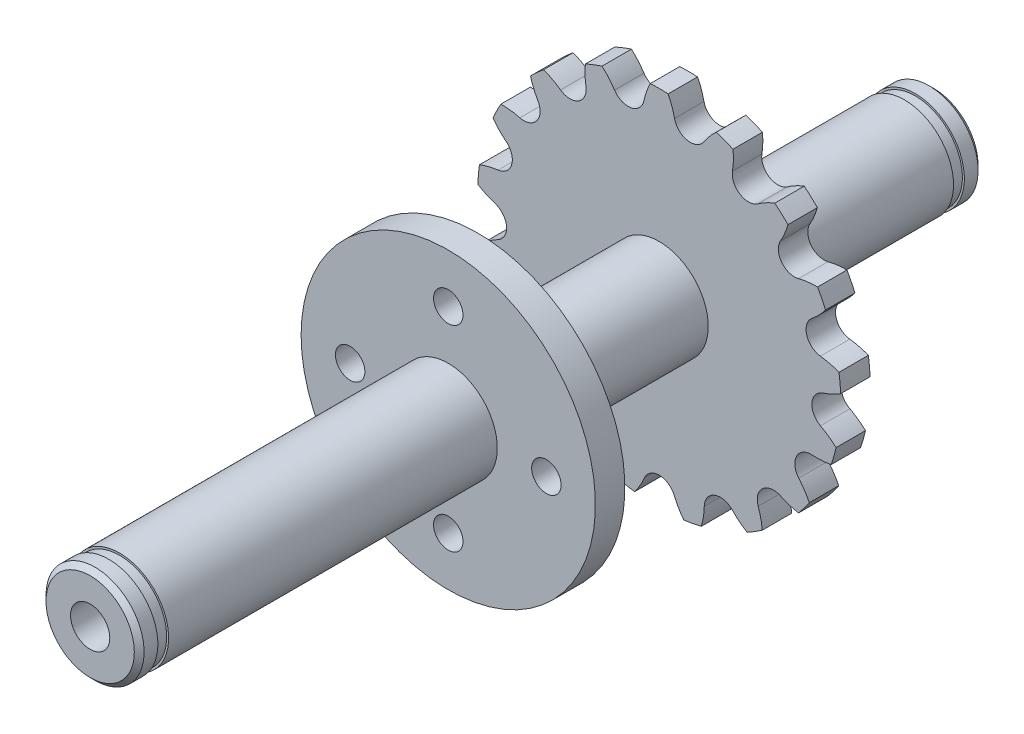
from build123d import *

# Parameters (mm, degrees)
EXTRUDE_2_DEPTH     = 3
SKETCH_2_R          = 5
EXTRUDE_3_DEPTH     = 25
EXTRUDE_START       = 58
SKETCH_3_R          = 5
EXTRUDE_4_DEPTH     = 58
SKETCH_4_R          = 15
EXTRUDE_5_DEPTH     = 3
SKETCH_5_R          = 1.5
CUT_EXTRUDE_1_DEPTH = 3
SKETCH_7_R          = 2
CUT_EXTRUDE_2_DEPTH = 90
SKETCH_9_W          = 0.2
SKETCH_9_H          = 1.1
CHAMFER_3_SIZE      = 0.5


with BuildPart() as part:
    # 草图1 → 凸台-拉伸2 (new body)
    with BuildSketch(Plane.XY):
        with BuildLine():
            ThreePointArc((-11.779760181, 14.271379579), (-12.466737886, 13.675360013), (-13.123601243, 13.046306581))
            ThreePointArc((-13.123601243, 13.046306581), (-12.803108373, 12.120767872), (-12.365117817, 11.24469604))
            ThreePointArc((-12.365117817, 11.24469604), (-12.142820781, 10.31561124), (-12.473009262, 9.419179367))
            ThreePointArc((-12.473009262, 9.419179367), (-13.244860059, 8.856275392), (-14.199312115, 8.815830257))
            ThreePointArc((-14.199312115, 8.815830257), (-15.161802274, 8.997352368), (-16.139716175, 9.052324938))
            ThreePointArc((-16.139716175, 9.052324938), (-16.564996707, 8.248388274), (-16.950263236, 7.424527004))
            ThreePointArc((-16.950263236, 7.424527004), (-16.317069389, 6.677263239), (-15.592181711, 6.018571022))
            ThreePointArc((-15.592181711, 6.018571022), (-15.049271757, 5.2325282), (-15.033334803, 4.277352535))
            ThreePointArc((-15.033334803, 4.277352535), (-15.549719866, 3.473635543), (-16.425109435, 3.091133726))
            ThreePointArc((-16.425109435, 3.091133726), (-17.388178129, 2.912706505), (-18.319914067, 2.610703653))
            ThreePointArc((-18.319914067, 2.610703653), (-18.426060932, 1.707425992), (-18.487698254, 0.800023914))
            ThreePointArc((-18.487698254, 0.800023914), (-17.627319769, 0.331957205), (-16.713435066, -0.020395362))
            ThreePointArc((-16.713435066, -0.020395362), (-15.923235192, -0.557236769), (-15.563325175, -1.442154458))
            ThreePointArc((-15.563325175, -1.442154458), (-15.754503841, -2.378138035), (-16.432604711, -3.051037542))
            ThreePointArc((-16.432604711, -3.051037542), (-17.266184176, -3.565316511), (-18.02590605, -4.183507626))
            ThreePointArc((-18.02590605, -4.183507626), (-17.798583527, -5.064133631), (-17.528267179, -5.932526839))
            ThreePointArc((-17.528267179, -5.932526839), (-16.556902937, -6.058181489), (-15.577446402, -6.056607239))
            ThreePointArc((-15.577446402, -6.056607239), (-14.64667748, -6.271743824), (-13.991402244, -6.966890501))
            ThreePointArc((-13.991402244, -6.966890501), (-13.831554774, -7.908730892), (-14.220785664, -8.781149285))
            ThreePointArc((-14.220785664, -8.781149285), (-14.812296375, -9.561823776), (-15.297399536, -10.412713019))
            ThreePointArc((-15.297399536, -10.412713019), (-14.767308791, -11.151753946), (-14.201546494, -11.863856968))
            ThreePointArc((-14.201546494, -11.863856968), (-13.250384619, -11.630129203), (-12.337637284, -11.274840748))
            ThreePointArc((-12.337637284, -11.274840748), (-11.392004814, -11.139217123), (-10.52986291, -11.550709376))
            ThreePointArc((-10.52986291, -11.550709376), (-10.040577591, -12.371205819), (-10.088370713, -13.325318158))
            ThreePointArc((-10.088370713, -13.325318158), (-10.357925871, -14.266953756), (-10.502894449, -15.23562382))
            ThreePointArc((-10.502894449, -15.23562382), (-9.741627174, -15.733268097), (-8.956828262, -16.192907475))
            ThreePointArc((-8.956828262, -16.192907475), (-8.154328435, -15.631363523), (-7.431561886, -14.970344538))
            ThreePointArc((-7.431561886, -14.970344538), (-6.598778773, -14.502277424), (-5.646207243, -14.574540946))
            ThreePointArc((-5.646207243, -14.574540946), (-4.893564768, -15.162880849), (-4.593465396, -16.069828976))
            ThreePointArc((-4.593465396, -16.069828976), (-4.504660083, -17.045252575), (-4.289915268, -18.000879201))
            ThreePointArc((-4.289915268, -18.000879201), (-3.400284827, -18.18991721), (-2.502440741, -18.335016099))
            ThreePointArc((-2.502440741, -18.335016099), (-1.956985011, -17.521495584), (-1.521812876, -16.644020345))
            ThreePointArc((-1.521812876, -16.644020345), (-0.914351093, -15.9067248), (0, -15.63))
            ThreePointArc((0, -15.63), (0.914351093, -15.9067248), (1.521812876, -16.644020345))
            ThreePointArc((1.521812876, -16.644020345), (1.956985011, -17.521495584), (2.502440741, -18.335016099))
            ThreePointArc((2.502440741, -18.335016099), (3.400284827, -18.18991721), (4.289915268, -18.000879201))
            ThreePointArc((4.289915268, -18.000879201), (4.504660083, -17.045252575), (4.593465396, -16.069828976))
            ThreePointArc((4.593465396, -16.069828976), (4.893564768, -15.162880849), (5.646207243, -14.574540946))
            ThreePointArc((5.646207243, -14.574540946), (6.598778773, -14.502277424), (7.431561886, -14.970344538))
            ThreePointArc((7.431561886, -14.970344538), (8.154328435, -15.631363523), (8.956828262, -16.192907475))
            ThreePointArc((8.956828262, -16.192907475), (9.741627174, -15.733268097), (10.502894449, -15.23562382))
            ThreePointArc((10.502894449, -15.23562382), (10.357925871, -14.266953756), (10.088370713, -13.325318158))
            ThreePointArc((10.088370713, -13.325318158), (10.040577591, -12.371205819), (10.52986291, -11.550709376))
            ThreePointArc((10.52986291, -11.550709376), (11.392004814, -11.139217123), (12.337637284, -11.274840748))
            ThreePointArc((12.337637284, -11.274840748), (13.250384619, -11.630129203), (14.201546494, -11.863856968))
            ThreePointArc((14.201546494, -11.863856968), (14.767308791, -11.151753946), (15.297399536, -10.412713019))
            ThreePointArc((15.297399536, -10.412713019), (14.812296375, -9.561823776), (14.220785664, -8.781149285))
            ThreePointArc((14.220785664, -8.781149285), (13.831554774, -7.908730892), (13.991402244, -6.966890501))
            ThreePointArc((13.991402244, -6.966890501), (14.64667748, -6.271743824), (15.577446402, -6.056607239))
            ThreePointArc((15.577446402, -6.056607239), (16.556902937, -6.058181489), (17.528267179, -5.932526839))
            ThreePointArc((17.528267179, -5.932526839), (17.798583527, -5.064133631), (18.02590605, -4.183507626))
            ThreePointArc((18.02590605, -4.183507626), (17.266184176, -3.565316511), (16.432604711, -3.051037542))
            ThreePointArc((16.432604711, -3.051037542), (15.754503841, -2.378138035), (15.563325175, -1.442154458))
            ThreePointArc((15.563325175, -1.442154458), (15.923235192, -0.557236769), (16.713435066, -0.020395362))
            ThreePointArc((16.713435066, -0.020395362), (17.627319769, 0.331957205), (18.487698254, 0.800023914))
            ThreePointArc((18.487698254, 0.800023914), (18.426060932, 1.707425992), (18.319914067, 2.610703653))
            ThreePointArc((18.319914067, 2.610703653), (17.388178129, 2.912706505), (16.425109435, 3.091133726))
            ThreePointArc((16.425109435, 3.091133726), (15.549719866, 3.473635543), (15.033334803, 4.277352535))
            ThreePointArc((15.033334803, 4.277352535), (15.049271757, 5.2325282), (15.592181711, 6.018571022))
            ThreePointArc((15.592181711, 6.018571022), (16.317069389, 6.677263239), (16.950263236, 7.424527004))
            ThreePointArc((16.950263236, 7.424527004), (16.564996707, 8.248388274), (16.139716175, 9.052324938))
            ThreePointArc((16.139716175, 9.052324938), (15.161802274, 8.997352368), (14.199312115, 8.815830257))
            ThreePointArc((14.199312115, 8.815830257), (13.244860059, 8.856275392), (12.473009262, 9.419179367))
            ThreePointArc((12.473009262, 9.419179367), (12.142820781, 10.31561124), (12.365117817, 11.24469604))
            ThreePointArc((12.365117817, 11.24469604), (12.803108373, 12.120767872), (13.123601243, 13.046306581))
            ThreePointArc((13.123601243, 13.046306581), (12.466737886, 13.675360013), (11.779760181, 14.271379579))
            ThreePointArc((11.779760181, 14.271379579), (10.887741008, 13.866855937), (10.055819013, 13.349900061))
            ThreePointArc((10.055819013, 13.349900061), (9.151208508, 13.042826175), (8.228134706, 13.288893831))
            ThreePointArc((8.228134706, 13.288893831), (7.596414573, 14.005513822), (7.468076245, 14.952162548))
            ThreePointArc((7.468076245, 14.952162548), (7.560016626, 15.927295641), (7.524524182, 16.906110163))
            ThreePointArc((7.524524182, 16.906110163), (6.684777033, 17.255398605), (5.8288823, 17.563005328))
            ThreePointArc((5.8288823, 17.563005328), (5.143229987, 16.863563773), (4.554231832, 16.080991887))
            ThreePointArc((4.554231832, 16.080991887), (3.821635541, 15.46787101), (2.872004963, 15.363869548))
            ThreePointArc((2.872004963, 15.363869548), (2.024070484, 15.803894155), (1.562429593, 16.640256651))
            ThreePointArc((1.562429593, 16.640256651), (1.295902743, 17.582753877), (0.909218435, 18.482649887))
            ThreePointArc((0.909218435, 18.482649887), (0, 18.505), (-0.909218435, 18.482649887))
            ThreePointArc((-0.909218435, 18.482649887), (-1.295902743, 17.582753877), (-1.562429593, 16.640256651))
            ThreePointArc((-1.562429593, 16.640256651), (-2.024070484, 15.803894155), (-2.872004963, 15.363869548))
            ThreePointArc((-2.872004963, 15.363869548), (-3.821635541, 15.46787101), (-4.554231832, 16.080991887))
            ThreePointArc((-4.554231832, 16.080991887), (-5.143229987, 16.863563773), (-5.8288823, 17.563005328))
            ThreePointArc((-5.8288823, 17.563005328), (-6.684777033, 17.255398605), (-7.524524182, 16.906110163))
            ThreePointArc((-7.524524182, 16.906110163), (-7.560016626, 15.927295641), (-7.468076245, 14.952162548))
            ThreePointArc((-7.468076245, 14.952162548), (-7.596414573, 14.005513822), (-8.228134706, 13.288893831))
            ThreePointArc((-8.228134706, 13.288893831), (-9.151208508, 13.042826175), (-10.055819013, 13.349900061))
            ThreePointArc((-10.055819013, 13.349900061), (-10.887741008, 13.866855937), (-11.779760181, 14.271379579))
        make_face()
    extrude(amount=EXTRUDE_2_DEPTH)

    # 草图2 → 凸台-拉伸3 (add)
    with BuildSketch(Plane(origin=(0, 0, 0), x_dir=(-1, 0, 0), z_dir=(0, 0, -1))):
        with Locations(Location((0, 0, 0), (0, 0, 180))):
            Circle(SKETCH_2_R)
    extrude(amount=EXTRUDE_3_DEPTH)

    # 草图3 → 凸台-拉伸4 (add)
    with BuildSketch(Plane.XY.offset(3).offset(EXTRUDE_START)):
        Circle(SKETCH_3_R)
    extrude(amount=-EXTRUDE_4_DEPTH)

    # 草图4 → 凸台-拉伸5 (add)
    with BuildSketch(Plane(origin=(0, 0, 21.5), x_dir=(-1, 0, 0), z_dir=(0, 0, -1))):
        Circle(SKETCH_4_R)
    extrude(amount=-EXTRUDE_5_DEPTH)

    # 草图5 → 切除-拉伸1 (cut)
    with BuildSketch(Plane.XY.offset(24.5)):
        with Locations((0, 10)):
            Circle(SKETCH_5_R)
        with Locations((10, 0)):
            Circle(SKETCH_5_R)
        with Locations((0, -10)):
            Circle(SKETCH_5_R)
        with Locations((-10, 0)):
            Circle(SKETCH_5_R)
    extrude(amount=-CUT_EXTRUDE_1_DEPTH, mode=Mode.SUBTRACT)

    # 草图7 → 切除-拉伸2 (cut)
    with BuildSketch(Plane(origin=(0, 0, -25), x_dir=(-1, 0, 0), z_dir=(0, 0, -1))):
        Circle(SKETCH_7_R)
    extrude(amount=-CUT_EXTRUDE_2_DEPTH, mode=Mode.SUBTRACT)

    # 草图9 → 切除-旋转2 (revolve, cut)
    with BuildSketch(Plane(origin=(0, 0, 0), x_dir=(1, 0, 0), z_dir=(0, 1, 0)), mode=Mode.PRIVATE) as cut_revolve_2_sk:
        with Locations((4.9, 22.55)):
            Rectangle(SKETCH_9_W, SKETCH_9_H)
        with Locations((4.9, -58.55)):
            Rectangle(SKETCH_9_W, SKETCH_9_H)
    revolve(cut_revolve_2_sk.sketch.rotate(Axis((0, 0, -25), (0, 0, 1)), 180), axis=Axis((0, 0, -25), (0, 0, 1)), mode=Mode.SUBTRACT)

    # 倒角3
    chamfer_3_edges = [part.edges().sort_by_distance(p)[0] for p in [
        (-5, 0, -25),
        (-5, 0, 61),
    ]]
    chamfer(chamfer_3_edges, length=CHAMFER_3_SIZE)


solid = part.part
